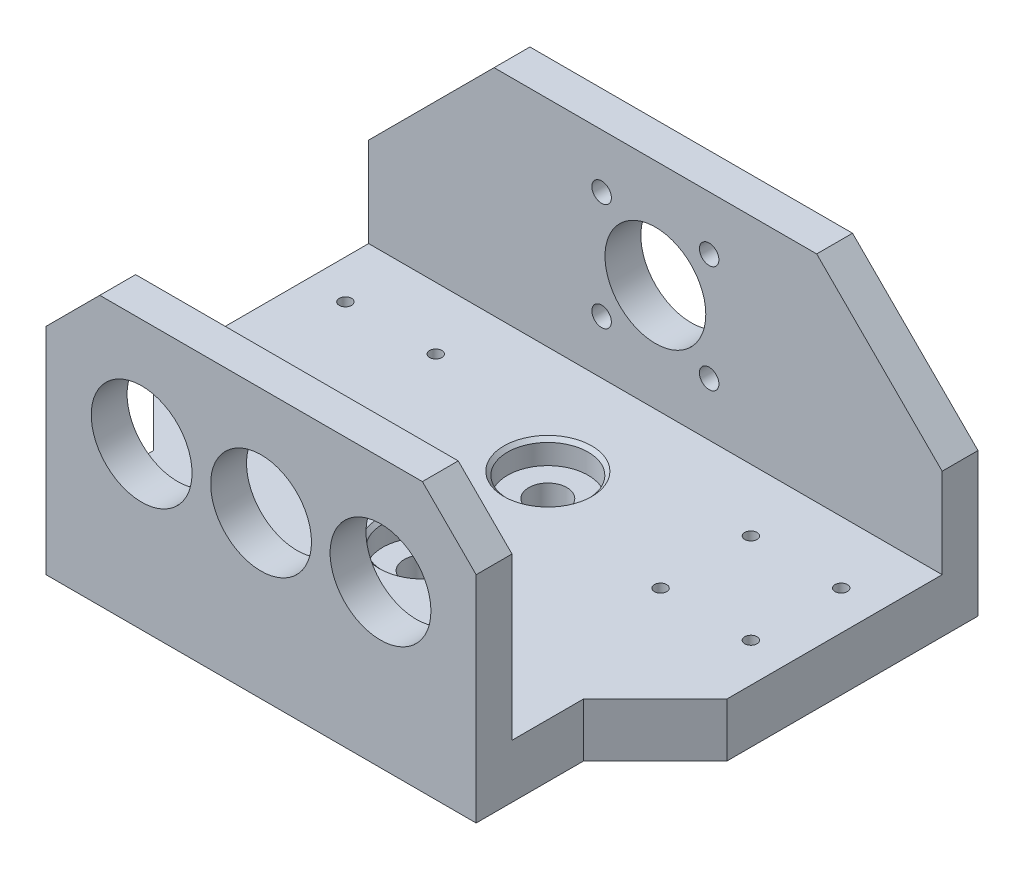
from build123d import *

# Parameters (mm, degrees)
SKETCH1_W                                    = 101.6
SKETCH1_H                                    = 76.2
BOSS_EXTRUDE1_DEPTH                          = 50.8
CUT_EXTRUDE1_DEPTH                           = 31.75
CUT_EXTRUDE1_DEPTH_BACK                      = 31.75
SKETCH9_W                                    = 101.6
SKETCH9_H                                    = 41.275
F_45_64_0_70313_DIAMETER_HOLE1_D             = 17.859502
F_45_64_0_70313_DIAMETER_HOLE2_D             = 17.859502
F_45_64_0_70313_DIAMETER_HOLE2_DEPTH         = 25.4
F_45_64_0_70313_DIAMETER_HOLE2_TIP           = 5.365535714
CBORE_FOR_1_4_BINDING_HEAD_MACHINE_S_2_COUNT = 2
CBORE_FOR_1_4_BINDING_HEAD_MACHINE_S_2_PITCH = 22.098
CUT_EXTRUDE3_DEPTH                           = 137.783186101
F_8_32_TAPPED_HOLE1_D                        = 3.4544
F_8_32_TAPPED_HOLE1_DEPTH                    = 6.35
CUT_EXTRUDE4_DEPTH                           = 136.636059457
F_44_0_086_DIAMETER_HOLE1_D                  = 2.1844


with BuildPart() as part:
    # Sketch1 → Boss-Extrude1 (new body)
    with BuildSketch(Plane(origin=(0, 0, 0), x_dir=(1, 0, 0), z_dir=(0, 1, 0))):
        with Locations((50.8, 38.1)):
            Rectangle(SKETCH1_W, SKETCH1_H)
    extrude(amount=BOSS_EXTRUDE1_DEPTH)

    # Sketch9 → Cut-Extrude1 (cut, two sides: drawn at the far end of the back side and taken through both)
    with BuildSketch(Plane.XY.offset(-38.1).offset(-CUT_EXTRUDE1_DEPTH_BACK)):
        with Locations((50.8, 30.1625)):
            Rectangle(SKETCH9_W, SKETCH9_H)
    extrude(amount=CUT_EXTRUDE1_DEPTH + CUT_EXTRUDE1_DEPTH_BACK, mode=Mode.SUBTRACT)

    # 45/64 (0.70313) Diameter Hole1 (through all)
    with Locations(Plane.XY):
        with Locations((50.8, 28.5242)):
            Hole(F_45_64_0_70313_DIAMETER_HOLE1_D / 2)

    # 45/64 (0.70313) Diameter Hole2
    with Locations(Plane.XY):
        with Locations((29.6418, 28.5242), (71.9582, 28.5242)):
            Hole(F_45_64_0_70313_DIAMETER_HOLE2_D / 2, depth=F_45_64_0_70313_DIAMETER_HOLE2_DEPTH)
            with Locations((0, 0, -(F_45_64_0_70313_DIAMETER_HOLE2_DEPTH + F_45_64_0_70313_DIAMETER_HOLE2_TIP / 2))):  # 118° drill point
                Cone(0, F_45_64_0_70313_DIAMETER_HOLE2_D / 2, F_45_64_0_70313_DIAMETER_HOLE2_TIP, mode=Mode.SUBTRACT)

    # Sketch14 → CBORE for 1/4 Binding Head Machine Screw1 (revolve, cut)
    with BuildSketch(Plane(origin=(50.8, 9.525, -50.8), x_dir=(0, 0, 1), z_dir=(1, 0, 0))):
        Polygon((0, 0), (0, 9.525), (3.3782, 9.525), (3.3782, 4.191), (7.14375, 4.191), (7.14375, 0.635), (7.77875, 0), align=None)
    cbore_for_1_4_binding_head_machine_screw = revolve(axis=Axis((50.8, 15.875, -50.8), (0, -1, 0)), mode=Mode.SUBTRACT)

    # CBORE for 1_4 Binding Head Machine S 2: CBORE for 1/4 Binding Head Machine Screw1 ×2
    with Locations(*[(0, 0, i * CBORE_FOR_1_4_BINDING_HEAD_MACHINE_S_2_PITCH) for i in range(1, CBORE_FOR_1_4_BINDING_HEAD_MACHINE_S_2_COUNT)]):
        add(cbore_for_1_4_binding_head_machine_screw, mode=Mode.SUBTRACT)

    # Sketch17 → Cut-Extrude3 (cut, through all)
    with BuildSketch(Plane.XY):
        Polygon((0, 25.4), (22.225, 47.625), (79.375, 47.625), (101.6, 25.4), (101.6, 50.8), (0, 50.8), align=None)
    extrude(amount=-CUT_EXTRUDE3_DEPTH, mode=Mode.SUBTRACT)

    # #8-32 Tapped Hole1
    with Locations(Plane(origin=(0, 0, -76.2), x_dir=(-1, 0, 0), z_dir=(0, 0, -1))):
        with Locations((-41.275, 38.0492), (-60.325, 18.9992), (-60.325, 38.0492), (-41.275, 18.9992)):
            Hole(F_8_32_TAPPED_HOLE1_D / 2, depth=F_8_32_TAPPED_HOLE1_DEPTH)

    # Sketch21 → Cut-Extrude4 (cut, through all)
    with BuildSketch(Plane.XZ):
        Polygon((0, 0), (0, -31.75), (12.7, -19.05), (12.7, 0), align=None)
        Polygon((88.9, 0), (101.6, 0), (101.6, -31.75), (88.9, -19.05), align=None)
    extrude(amount=-CUT_EXTRUDE4_DEPTH, mode=Mode.SUBTRACT)

    # #44 (0.086) Diameter Hole1 (through all)
    with Locations(Plane(origin=(0, 0, 0), x_dir=(-1, 0, 0), z_dir=(0, -1, 0))):
        with Locations((-22.8844, 58.8518), (-6.8844, 58.8518), (-22.8844, 42.8518), (-6.8844, 42.8518), (-78.7156, 58.8518), (-94.7156, 58.8518), (-78.7156, 42.8518), (-94.7156, 42.8518)):
            Hole(F_44_0_086_DIAMETER_HOLE1_D / 2)


solid = part.part
